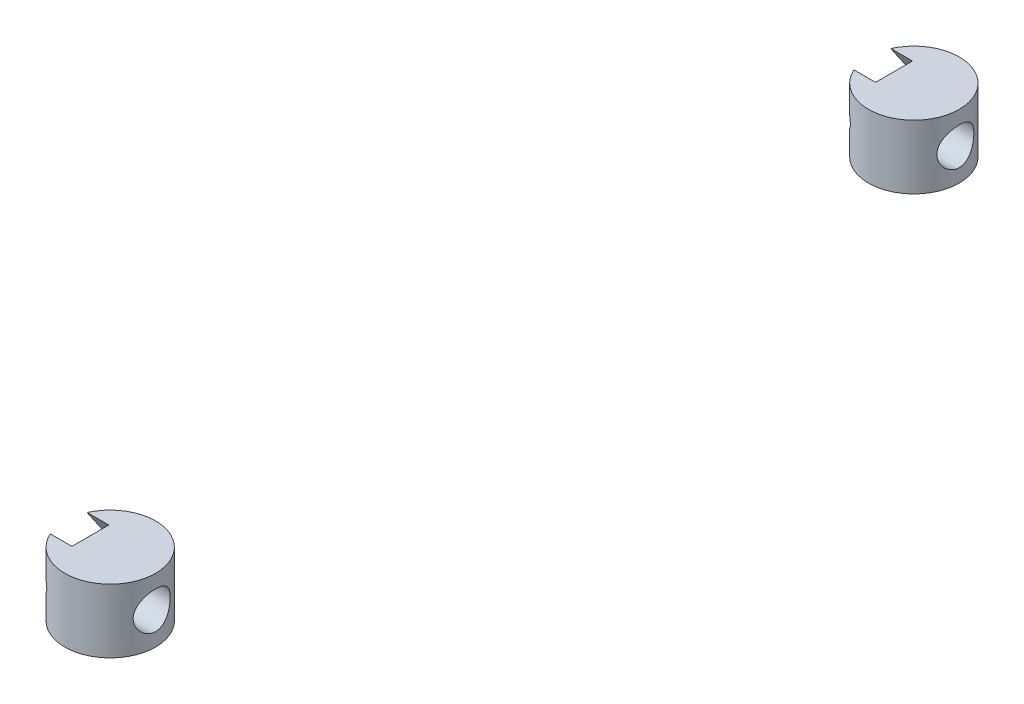
from build123d import *

# Parameters (mm, degrees)
SKETCH1_R               = 9.025
BOSS_EXTRUDE1_DEPTH     = 12.7
BOSS_EXTRUDE1_2_DEPTH   = 12.7
CUT_EXTRUDE1_DEPTH      = 91.254920226
CUT_EXTRUDE1_DEPTH_BACK = 91.254920226
SKETCH2_R               = 3.675
CUT_EXTRUDE2_DEPTH      = 5.08


with BuildPart() as part:
    # Sketch1 → Boss-Extrude1 (new body)
    with BuildSketch(Plane(origin=(0, 0, 0), x_dir=(1, 0, 0), z_dir=(0, 1, 0))):
        with Locations(Location((0, 79.875, 0), (0, 0, 270))):
            Circle(SKETCH1_R)
    extrude(amount=BOSS_EXTRUDE1_DEPTH)


with BuildPart() as body_2:
    # Sketch1 → Boss-Extrude1 2 (new body)
    with BuildSketch(Plane(origin=(0, 0, 0), x_dir=(1, 0, 0), z_dir=(0, 1, 0))):
        with Locations(Location((0, -79.875, 0), (0, 0, 270))):
            Circle(SKETCH1_R)
    extrude(amount=BOSS_EXTRUDE1_2_DEPTH)


with BuildPart() as cut_extrude1_tool:
    # Sketch2 → Cut-Extrude1 (new, two sides: drawn at the far end of the back side and taken through both)
    with BuildSketch(Plane(origin=(0, 0, 0), x_dir=(0, 0, -1), z_dir=(1, 0, 0)).offset(-CUT_EXTRUDE1_DEPTH_BACK)):
        with Locations((-79.875, 6.35)):
            Circle(SKETCH2_R)
        with Locations((79.875, 6.35)):
            Circle(SKETCH2_R)
    extrude(amount=CUT_EXTRUDE1_DEPTH + CUT_EXTRUDE1_DEPTH_BACK)


with BuildPart() as part_1:
    add(part.part)

    # Cut-Extrude1: cut by cut_extrude1_tool
    add(cut_extrude1_tool.part, mode=Mode.SUBTRACT)


with BuildPart() as body_2_1:
    add(body_2.part)

    # Cut-Extrude1: cut by cut_extrude1_tool
    add(cut_extrude1_tool.part, mode=Mode.SUBTRACT)


with BuildPart() as cut_extrude2_tool:
    # Sketch3 → Cut-Extrude2 (new body)
    with BuildSketch(Plane.ZY.offset(9.025)):
        Polygon((83.541174209, 0), (87.207348419, 6.35), (83.541174209, 12.7), (76.208825791, 12.7), (72.542651581, 6.35), (76.208825791, 0), align=None)
        Polygon((-76.208825791, 0), (-83.541174209, 0), (-87.207348419, 6.35), (-83.541174209, 12.7), (-76.208825791, 12.7), (-72.542651581, 6.35), align=None)
    extrude(amount=-CUT_EXTRUDE2_DEPTH)


with BuildPart() as part_2:
    add(part_1.part)

    # Cut-Extrude2: cut by cut_extrude2_tool
    add(cut_extrude2_tool.part, mode=Mode.SUBTRACT)


with BuildPart() as body_2_2:
    add(body_2_1.part)

    # Cut-Extrude2: cut by cut_extrude2_tool
    add(cut_extrude2_tool.part, mode=Mode.SUBTRACT)


solid = Compound([part_2.part, body_2_2.part])
